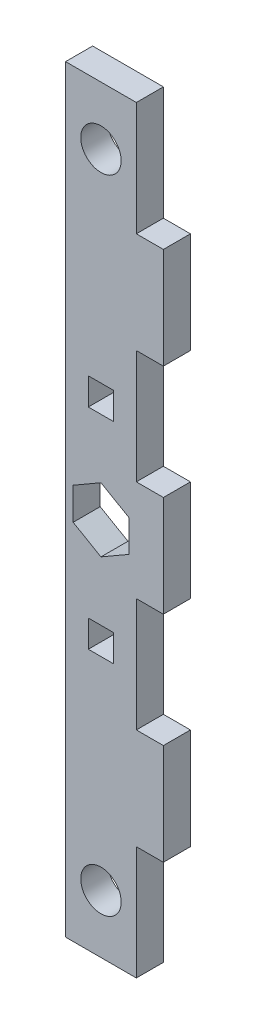
from build123d import *

# Parameters (mm, degrees)
MODEL_R             = 4
MODEL_W             = 4.999999889
MODEL_H             = 5.349997431
MODEL_H_2           = 5.350001156
BOSS_EXTRUDE1_DEPTH = 5.35


with BuildPart() as part:
    # Model → Boss-Extrude1 (new body)
    with BuildSketch(Plane.XY):
        Polygon((14.000000432, 127.499997616), (14.000000432, 150.00000596), (0, 150.00000596), (0, 0), (14.000000432, 0), (14.000000432, 22.500000894), (19.349999726, 22.500000894), (19.349999726, 42.500000447), (14.000000432, 42.500000447), (14.000000432, 64.999997616), (19.349999726, 64.999997616), (19.349999726, 85.000000894), (14.000000432, 85.000000894), (14.000000432, 107.500001788), (19.349999726, 107.500001788), (19.349999726, 127.499997616), align=None)
        with Locations((7, 11.5)):
            Circle(MODEL_R, mode=Mode.SUBTRACT)
        with Locations((7, 138.5)):
            Circle(MODEL_R, mode=Mode.SUBTRACT)
        with Locations((6.999999751, 54.250000044)):
            Rectangle(MODEL_W, MODEL_H, mode=Mode.SUBTRACT)
        with Locations((6.999999751, 95.750000328)):
            Rectangle(MODEL_W, MODEL_H_2, mode=Mode.SUBTRACT)
        Polygon((1.500000013, 71.82457298), (7.000000216, 68.649150431), (12.500000186, 71.82457298), (12.500000186, 78.175425529), (7.000000216, 81.350855529), (1.500000013, 78.175425529), align=None, mode=Mode.SUBTRACT)
    extrude(amount=BOSS_EXTRUDE1_DEPTH)


solid = part.part
